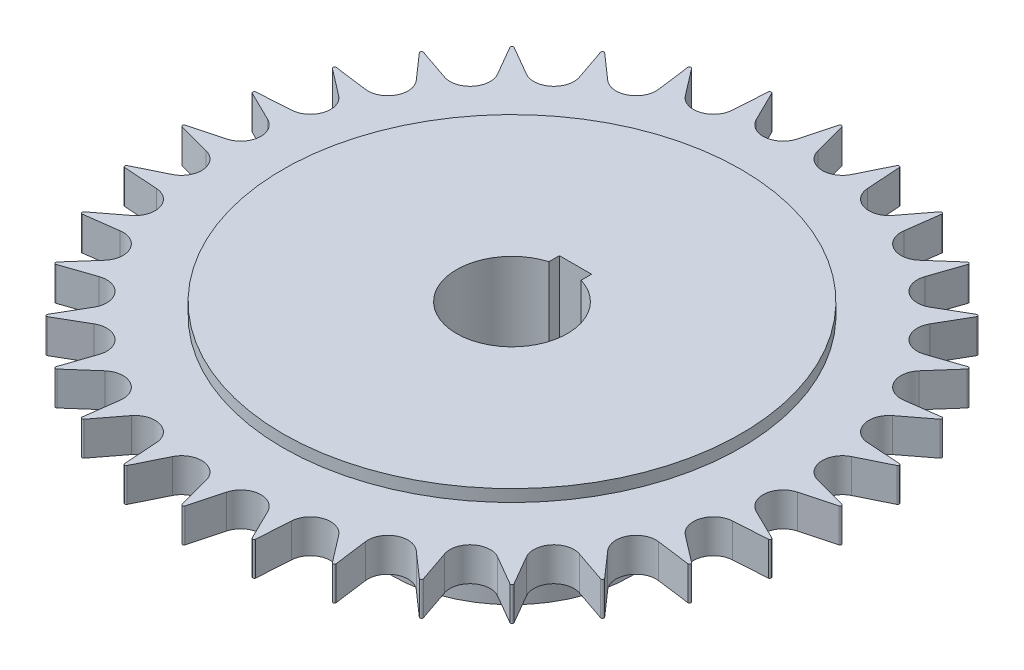
from build123d import *

# Parameters (mm, degrees)
BOSS_EXTRUDE1_DEPTH = 10.5
SKETCH2_R           = 142.5
BOSS_EXTRUDE2_DEPTH = 7.5
SKETCH3_R           = 74
BOSS_EXTRUDE3_DEPTH = 75
CUT_EXTRUDE1_DEPTH  = 311.436789057


with BuildPart() as part:
    # Sketch1 → Boss-Extrude1 (new, symmetric)
    with BuildSketch(Plane(origin=(0, 0, 0), x_dir=(1, 0, 0), z_dir=(0, 1, 0))):
        with BuildLine():
            Line((-6.353555334, 183.919257869), (-0.921852287, 204.291728771))
            ThreePointArc((-0.921852287, 204.291728771), (0, 205), (0.921852287, 204.291728771))
            Line((0.921852287, 204.291728771), (6.353555334, 183.919257869))
            ThreePointArc((6.353555334, 183.919257869), (17.206418899, 174.699702844), (29.649393692, 181.624818057))
            Line((29.649393692, 181.624818057), (38.951199998, 200.546164947))
            ThreePointArc((38.951199998, 200.546164947), (39.993516013, 201.060982483), (40.759478305, 200.186476028))
            Line((40.759478305, 200.186476028), (42.112340793, 179.145783744))
            ThreePointArc((42.112340793, 179.145783744), (50.958023669, 167.986091236), (64.512933147, 172.350638343))
            Line((64.512933147, 172.350638343), (77.32737951, 189.09372447))
            ThreePointArc((77.32737951, 189.09372447), (78.450103635, 189.395304165), (79.03074043, 188.388169276))
            Line((79.03074043, 188.388169276), (76.252772611, 167.487837617))
            ThreePointArc((76.252772611, 167.487837617), (82.751340166, 154.81686835), (96.89727676, 156.453120253))
            Line((96.89727676, 156.453120253), (112.731911194, 170.374518208))
            ThreePointArc((112.731911194, 170.374518208), (113.891897769, 170.451270522), (114.264895521, 169.350210829))
            Line((114.264895521, 169.350210829), (107.462853142, 149.393427818))
            ThreePointArc((107.462853142, 149.393427818), (111.364569069, 135.698120036), (125.557912368, 134.543196491))
            Line((125.557912368, 134.543196491), (143.804218752, 145.107914758))
            ThreePointArc((143.804218752, 145.107914758), (144.956890143, 144.956890143), (145.107914758, 143.804218752))
            Line((145.107914758, 143.804218752), (134.543196491, 125.557912368))
            ThreePointArc((134.543196491, 125.557912368), (135.698120036, 111.364569069), (149.393427818, 107.462853142))
            Line((149.393427818, 107.462853142), (169.350210829, 114.264895521))
            ThreePointArc((169.350210829, 114.264895521), (170.451270522, 113.891897769), (170.374518208, 112.731911194))
            Line((170.374518208, 112.731911194), (156.453120253, 96.89727676))
            ThreePointArc((156.453120253, 96.89727676), (154.81686835, 82.751340166), (167.487837617, 76.252772611))
            Line((167.487837617, 76.252772611), (188.388169276, 79.03074043))
            ThreePointArc((188.388169276, 79.03074043), (189.395304165, 78.450103635), (189.09372447, 77.32737951))
            Line((189.09372447, 77.32737951), (172.350638343, 64.512933147))
            ThreePointArc((172.350638343, 64.512933147), (167.986091236, 50.958023669), (179.145783744, 42.112340793))
            Line((179.145783744, 42.112340793), (200.186476028, 40.759478305))
            ThreePointArc((200.186476028, 40.759478305), (201.060982483, 39.993516013), (200.546164947, 38.951199998))
            Line((200.546164947, 38.951199998), (181.624818057, 29.649393692))
            ThreePointArc((181.624818057, 29.649393692), (174.699702844, 17.206418899), (183.919257869, 6.353555334))
            Line((183.919257869, 6.353555334), (204.291728771, 0.921852287))
            ThreePointArc((204.291728771, 0.921852287), (205, 0), (204.291728771, -0.921852287))
            Line((204.291728771, -0.921852287), (183.919257869, -6.353555334))
            ThreePointArc((183.919257869, -6.353555334), (174.699702844, -17.206418899), (181.624818057, -29.649393692))
            Line((181.624818057, -29.649393692), (200.546164947, -38.951199998))
            ThreePointArc((200.546164947, -38.951199998), (201.060982483, -39.993516013), (200.186476028, -40.759478305))
            Line((200.186476028, -40.759478305), (179.145783744, -42.112340793))
            ThreePointArc((179.145783744, -42.112340793), (167.986091236, -50.958023669), (172.350638343, -64.512933147))
            Line((172.350638343, -64.512933147), (189.09372447, -77.32737951))
            ThreePointArc((189.09372447, -77.32737951), (189.395304165, -78.450103635), (188.388169276, -79.03074043))
            Line((188.388169276, -79.03074043), (167.487837617, -76.252772611))
            ThreePointArc((167.487837617, -76.252772611), (154.81686835, -82.751340166), (156.453120253, -96.89727676))
            Line((156.453120253, -96.89727676), (170.374518208, -112.731911194))
            ThreePointArc((170.374518208, -112.731911194), (170.451270522, -113.891897769), (169.350210829, -114.264895521))
            Line((169.350210829, -114.264895521), (149.393427818, -107.462853142))
            ThreePointArc((149.393427818, -107.462853142), (135.698120036, -111.364569068), (134.543196491, -125.557912368))
            Line((134.543196491, -125.557912368), (145.107914758, -143.804218751))
            ThreePointArc((145.107914758, -143.804218751), (144.956890143, -144.956890143), (143.804218752, -145.107914758))
            Line((143.804218752, -145.107914758), (125.557912368, -134.543196491))
            ThreePointArc((125.557912368, -134.543196491), (111.364569069, -135.698120036), (107.462853142, -149.393427818))
            Line((107.462853142, -149.393427818), (114.264895521, -169.350210829))
            ThreePointArc((114.264895521, -169.350210829), (113.891897769, -170.451270522), (112.731911194, -170.374518208))
            Line((112.731911194, -170.374518208), (96.89727676, -156.453120253))
            ThreePointArc((96.89727676, -156.453120253), (82.751340166, -154.81686835), (76.252772611, -167.487837617))
            Line((76.252772611, -167.487837617), (79.03074043, -188.388169276))
            ThreePointArc((79.03074043, -188.388169276), (78.450103635, -189.395304165), (77.327379511, -189.09372447))
            Line((77.327379511, -189.09372447), (64.512933147, -172.350638343))
            ThreePointArc((64.512933147, -172.350638343), (50.958023669, -167.986091236), (42.112340793, -179.145783744))
            Line((42.112340793, -179.145783744), (40.759478305, -200.186476028))
            ThreePointArc((40.759478305, -200.186476028), (39.993516013, -201.060982483), (38.951199998, -200.546164947))
            Line((38.951199998, -200.546164947), (29.649393693, -181.624818057))
            ThreePointArc((29.649393693, -181.624818057), (17.206418899, -174.699702844), (6.353555334, -183.919257869))
            Line((6.353555334, -183.919257869), (0.921852287, -204.291728771))
            ThreePointArc((0.921852287, -204.291728771), (0, -205), (-0.921852287, -204.291728771))
            Line((-0.921852287, -204.291728771), (-6.353555334, -183.919257869))
            ThreePointArc((-6.353555334, -183.919257869), (-17.206418899, -174.699702844), (-29.649393692, -181.624818057))
            Line((-29.649393692, -181.624818057), (-38.951199998, -200.546164947))
            ThreePointArc((-38.951199998, -200.546164947), (-39.993516013, -201.060982483), (-40.759478305, -200.186476028))
            Line((-40.759478305, -200.186476028), (-42.112340793, -179.145783744))
            ThreePointArc((-42.112340793, -179.145783744), (-50.958023669, -167.986091236), (-64.512933147, -172.350638343))
            Line((-64.512933147, -172.350638343), (-77.32737951, -189.09372447))
            ThreePointArc((-77.32737951, -189.09372447), (-78.450103635, -189.395304165), (-79.03074043, -188.388169276))
            Line((-79.03074043, -188.388169276), (-76.252772611, -167.487837617))
            ThreePointArc((-76.252772611, -167.487837617), (-82.751340166, -154.81686835), (-96.89727676, -156.453120253))
            Line((-96.89727676, -156.453120253), (-112.731911194, -170.374518208))
            ThreePointArc((-112.731911194, -170.374518208), (-113.891897769, -170.451270522), (-114.264895521, -169.350210829))
            Line((-114.264895521, -169.350210829), (-107.462853142, -149.393427818))
            ThreePointArc((-107.462853142, -149.393427818), (-111.364569068, -135.698120036), (-125.557912368, -134.543196491))
            Line((-125.557912368, -134.543196491), (-143.804218751, -145.107914758))
            ThreePointArc((-143.804218751, -145.107914758), (-144.956890143, -144.956890143), (-145.107914758, -143.804218752))
            Line((-145.107914758, -143.804218752), (-134.543196491, -125.557912368))
            ThreePointArc((-134.543196491, -125.557912368), (-135.698120036, -111.364569069), (-149.393427818, -107.462853142))
            Line((-149.393427818, -107.462853142), (-169.350210829, -114.264895521))
            ThreePointArc((-169.350210829, -114.264895521), (-170.451270522, -113.891897769), (-170.374518208, -112.731911194))
            Line((-170.374518208, -112.731911194), (-156.453120253, -96.89727676))
            ThreePointArc((-156.453120253, -96.89727676), (-154.81686835, -82.751340166), (-167.487837617, -76.252772611))
            Line((-167.487837617, -76.252772611), (-188.388169276, -79.03074043))
            ThreePointArc((-188.388169276, -79.03074043), (-189.395304165, -78.450103635), (-189.09372447, -77.32737951))
            Line((-189.09372447, -77.32737951), (-172.350638343, -64.512933147))
            ThreePointArc((-172.350638343, -64.512933147), (-167.986091236, -50.958023669), (-179.145783744, -42.112340793))
            Line((-179.145783744, -42.112340793), (-200.186476028, -40.759478305))
            ThreePointArc((-200.186476028, -40.759478305), (-201.060982483, -39.993516013), (-200.546164947, -38.951199998))
            Line((-200.546164947, -38.951199998), (-181.624818057, -29.649393692))
            ThreePointArc((-181.624818057, -29.649393692), (-174.699702844, -17.206418899), (-183.919257869, -6.353555334))
            Line((-183.919257869, -6.353555334), (-204.291728771, -0.921852287))
            ThreePointArc((-204.291728771, -0.921852287), (-205, 0), (-204.291728771, 0.921852287))
            Line((-204.291728771, 0.921852287), (-183.919257869, 6.353555334))
            ThreePointArc((-183.919257869, 6.353555334), (-174.699702844, 17.206418899), (-181.624818057, 29.649393692))
            Line((-181.624818057, 29.649393692), (-200.546164947, 38.951199998))
            ThreePointArc((-200.546164947, 38.951199998), (-201.060982483, 39.993516013), (-200.186476028, 40.759478305))
            Line((-200.186476028, 40.759478305), (-179.145783744, 42.112340793))
            ThreePointArc((-179.145783744, 42.112340793), (-167.986091236, 50.958023669), (-172.350638343, 64.512933147))
            Line((-172.350638343, 64.512933147), (-189.09372447, 77.32737951))
            ThreePointArc((-189.09372447, 77.32737951), (-189.395304165, 78.450103635), (-188.388169276, 79.03074043))
            Line((-188.388169276, 79.03074043), (-167.487837617, 76.252772611))
            ThreePointArc((-167.487837617, 76.252772611), (-154.81686835, 82.751340166), (-156.453120253, 96.89727676))
            Line((-156.453120253, 96.89727676), (-170.374518208, 112.731911194))
            ThreePointArc((-170.374518208, 112.731911194), (-170.451270522, 113.891897769), (-169.350210829, 114.264895521))
            Line((-169.350210829, 114.264895521), (-149.393427818, 107.462853142))
            ThreePointArc((-149.393427818, 107.462853142), (-135.698120036, 111.364569068), (-134.543196491, 125.557912368))
            Line((-134.543196491, 125.557912368), (-145.107914758, 143.804218751))
            ThreePointArc((-145.107914758, 143.804218751), (-144.956890143, 144.956890143), (-143.804218751, 145.107914758))
            Line((-143.804218751, 145.107914758), (-125.557912368, 134.543196491))
            ThreePointArc((-125.557912368, 134.543196491), (-111.364569068, 135.698120036), (-107.462853142, 149.393427818))
            Line((-107.462853142, 149.393427818), (-114.264895521, 169.350210829))
            ThreePointArc((-114.264895521, 169.350210829), (-113.891897769, 170.451270522), (-112.731911194, 170.374518208))
            Line((-112.731911194, 170.374518208), (-96.89727676, 156.453120253))
            ThreePointArc((-96.89727676, 156.453120253), (-82.751340166, 154.81686835), (-76.252772611, 167.487837617))
            Line((-76.252772611, 167.487837617), (-79.03074043, 188.388169276))
            ThreePointArc((-79.03074043, 188.388169276), (-78.450103635, 189.395304165), (-77.32737951, 189.09372447))
            Line((-77.32737951, 189.09372447), (-64.512933147, 172.350638343))
            ThreePointArc((-64.512933147, 172.350638343), (-50.958023669, 167.986091236), (-42.112340793, 179.145783744))
            Line((-42.112340793, 179.145783744), (-40.759478305, 200.186476028))
            ThreePointArc((-40.759478305, 200.186476028), (-39.993516013, 201.060982483), (-38.951199998, 200.546164947))
            Line((-38.951199998, 200.546164947), (-29.649393692, 181.624818057))
            ThreePointArc((-29.649393692, 181.624818057), (-17.206418899, 174.699702844), (-6.353555334, 183.919257869))
        make_face()
    extrude(amount=BOSS_EXTRUDE1_DEPTH, both=True)

    # Sketch2 → Boss-Extrude2 (add)
    with BuildSketch(Plane(origin=(0, 10.5, 0), x_dir=(1, 0, 0), z_dir=(0, 1, 0))):
        with Locations(Location((0, 0, 0), (0, 0, 270))):
            Circle(SKETCH2_R)
    boss_extrude2 = extrude(amount=BOSS_EXTRUDE2_DEPTH)

    # Mirror1: Boss-Extrude2 across plane
    add(boss_extrude2.mirror(Plane.ZX))

    # Sketch3 → Boss-Extrude3 (add)
    with BuildSketch(Plane.XZ.offset(18)):
        with Locations(Location((0, 0, 0), (0, 0, 270))):
            Circle(SKETCH3_R)
    extrude(amount=BOSS_EXTRUDE3_DEPTH)

    # Sketch4 → Cut-Extrude1 (cut, through all)
    with BuildSketch(Plane(origin=(0, 18, 0), x_dir=(1, 0, 0), z_dir=(0, 1, 0))):
        with BuildLine():
            Line((-10, 39.5), (10, 39.5))
            Line((10, 39.5), (10, 33.018933962))
            ThreePointArc((10, 33.018933962), (0, -34.5), (-10, 33.018933962))
            Line((-10, 33.018933962), (-10, 39.5))
        make_face()
    extrude(amount=-CUT_EXTRUDE1_DEPTH, mode=Mode.SUBTRACT)


solid = part.part
